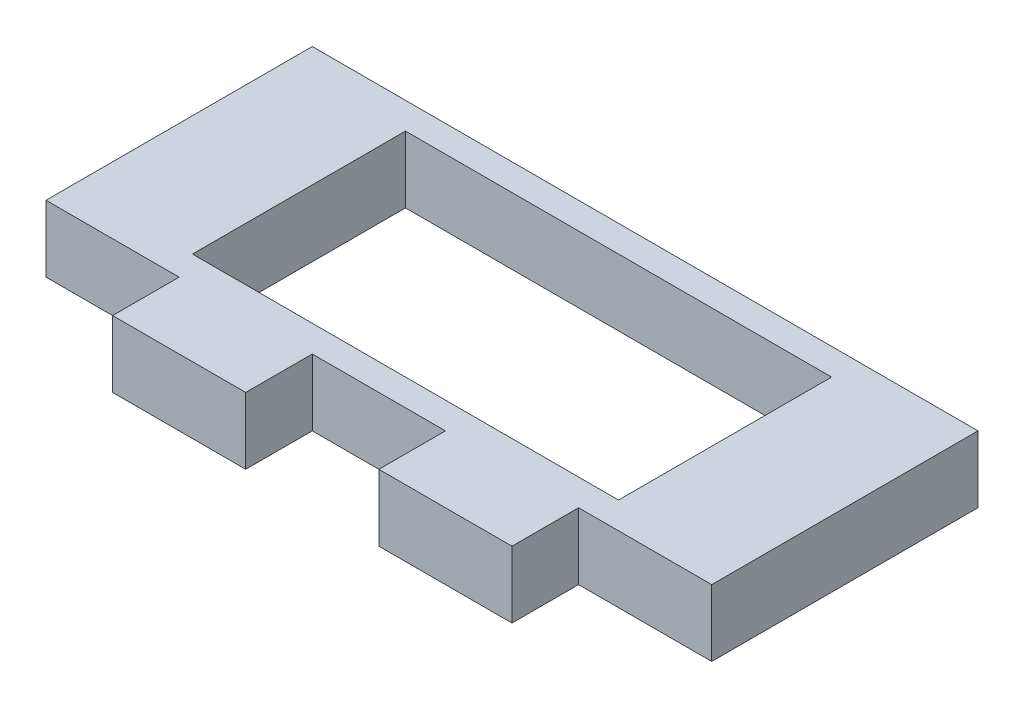
from build123d import *

# Parameters (mm, degrees)
SKETCH1_W           = 40.64
SKETCH1_H           = 20.32
BOSS_EXTRUDE1_DEPTH = 6.35


with BuildPart() as part:
    # Sketch1 → Boss-Extrude1 (new body)
    with BuildSketch(Plane(origin=(0, 0, 0), x_dir=(1, 0, 0), z_dir=(0, 1, 0))):
        Polygon((-31.75, 12.7), (31.75, 12.7), (31.75, -12.7), (19.05, -12.7), (19.05, -19.05), (6.35, -19.05), (6.35, -12.7), (-6.35, -12.7), (-6.35, -19.05), (-19.05, -19.05), (-19.05, -12.7), (-31.75, -12.7), align=None)
        Rectangle(SKETCH1_W, SKETCH1_H, mode=Mode.SUBTRACT)
    extrude(amount=BOSS_EXTRUDE1_DEPTH)


solid = part.part
